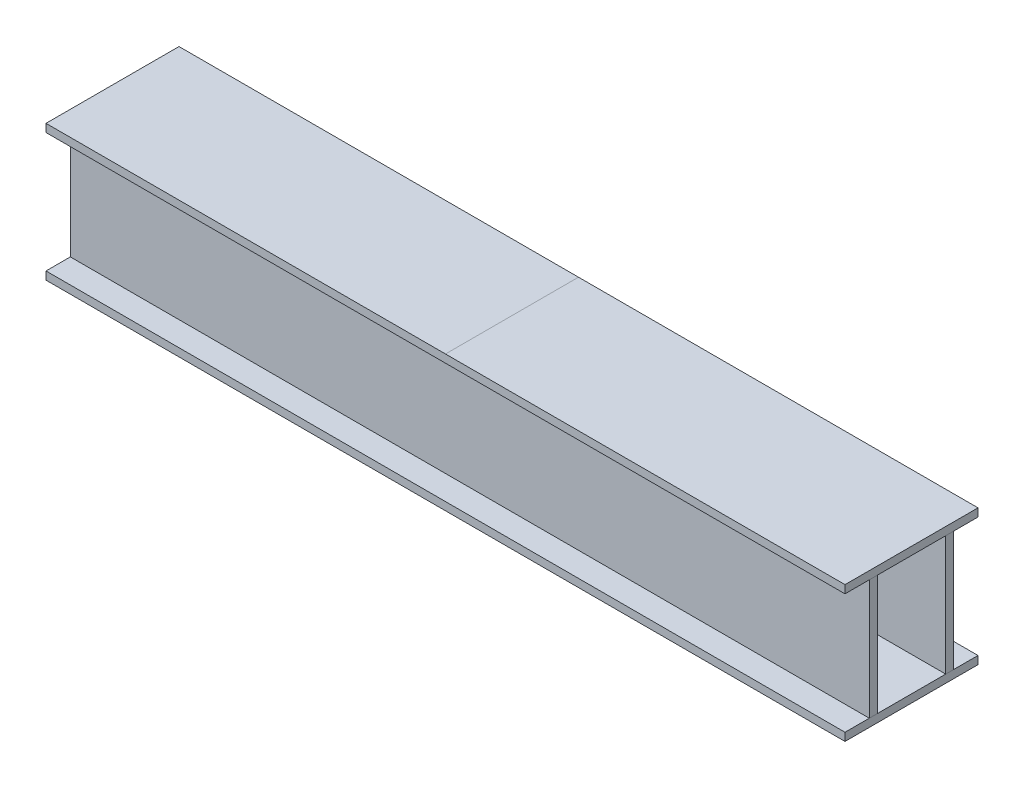
from build123d import *

# Parameters (mm, degrees)
SKETCH_1_W        = 166.456
SKETCH_1_H        = 10
EXTRUDE_1_DEPTH   = 500
EXTRUDE_1_2_DEPTH = 500
SKETCH_1_3_W      = 10
SKETCH_1_3_H      = 150
EXTRUDE_2_DEPTH   = 500
EXTRUDE_2_2_DEPTH = 500


with BuildPart() as part:
    # 草图1 → 凸台-拉伸1 (new, symmetric)
    with BuildSketch(Plane(origin=(0, 0, 0), x_dir=(0, 0, -1), z_dir=(1, 0, 0))):
        with Locations((0, 80)):
            Rectangle(SKETCH_1_W, SKETCH_1_H)
    extrude(amount=EXTRUDE_1_DEPTH, both=True)


with BuildPart() as body_2:
    # 草图1 → Extrude 1 2 (new, symmetric)
    with BuildSketch(Plane(origin=(0, 0, 0), x_dir=(0, 0, -1), z_dir=(1, 0, 0))):
        with Locations((0, -80)):
            Rectangle(SKETCH_1_W, SKETCH_1_H)
    extrude(amount=EXTRUDE_1_2_DEPTH, both=True)


with BuildPart() as body_3:
    # 草图1<3> → 凸台-拉伸2 (new, symmetric)
    with BuildSketch(Plane(origin=(0, 0, 0), x_dir=(0, 0, -1), z_dir=(1, 0, 0))):
        with Locations((-47.7975, 0)):
            Rectangle(SKETCH_1_3_W, SKETCH_1_3_H)
    extrude(amount=EXTRUDE_2_DEPTH, both=True)


with BuildPart() as body_4:
    # 草图1<3> → Extrude 2 2 (new, symmetric)
    with BuildSketch(Plane(origin=(0, 0, 0), x_dir=(0, 0, -1), z_dir=(1, 0, 0))):
        with Locations((47.7975, 0)):
            Rectangle(SKETCH_1_3_W, SKETCH_1_3_H)
    extrude(amount=EXTRUDE_2_2_DEPTH, both=True)


solid = Compound([part.part, body_2.part, body_3.part, body_4.part])
